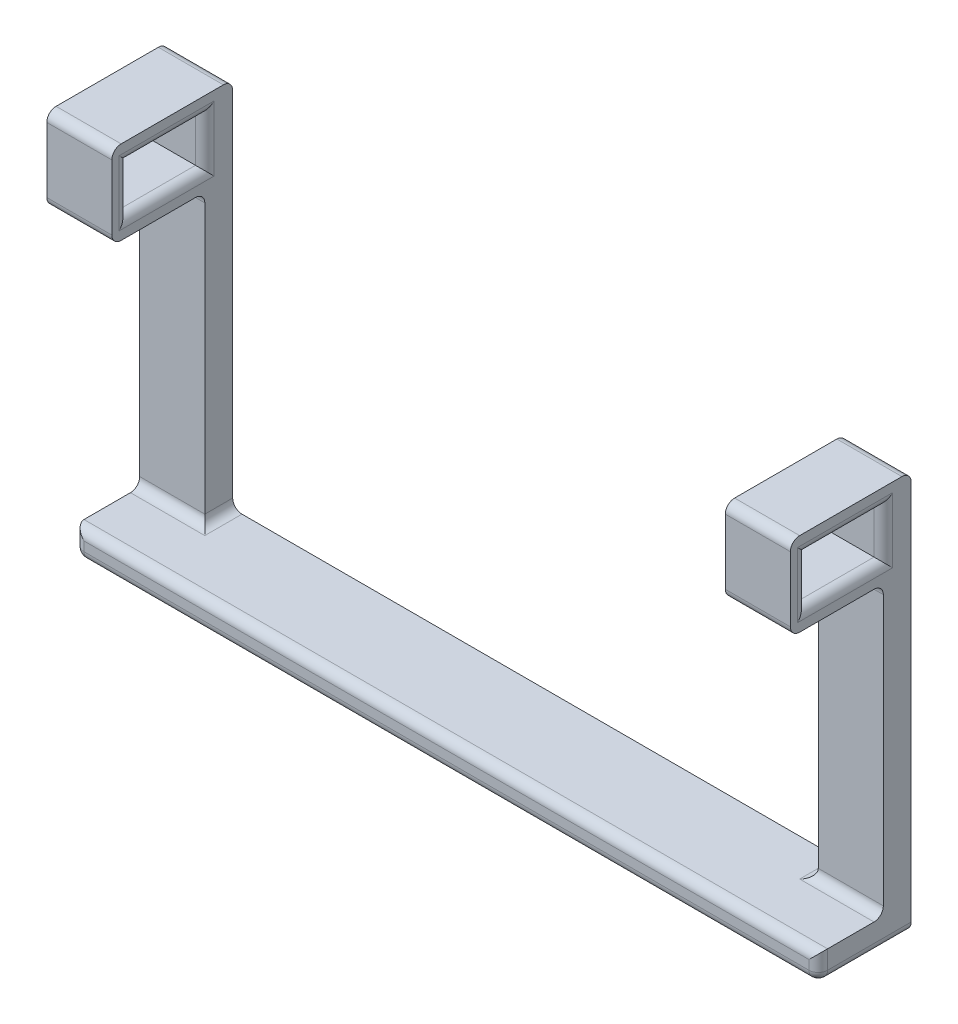
from build123d import *

# Parameters (mm, degrees)
BOSS_EXTRUDE1_DEPTH = 13
SKETCH2_W           = 8.229441325
SKETCH2_H           = 5
CUT_EXTRUDE1_DEPTH  = 100
FILLET1_R           = 1


with BuildPart() as part:
    # Sketch1 → Boss-Extrude1 (new body)
    with BuildSketch(Plane.XY):
        Polygon((0, 0), (40, 0), (40, 43), (33, 43), (33, 3), (0, 3), align=None)
    extrude(amount=BOSS_EXTRUDE1_DEPTH)

    # Sketch2 → Cut-Extrude1 (cut)
    with BuildSketch(Plane(origin=(40, 0, 0), x_dir=(0, 0, -1), z_dir=(1, 0, 0))):
        Polygon((-3, 34), (-13, 34), (-13, 0), (-10, 0), (-10, 3), (-3, 3), align=None)
        with Locations((-7.114720663, 38.5)):
            Rectangle(SKETCH2_W, SKETCH2_H)
    extrude(amount=-CUT_EXTRUDE1_DEPTH, mode=Mode.SUBTRACT)

    # Mirror2: part across plane


with BuildPart() as part_1:
    add(part.part)
    add(part.part.mirror(Plane(origin=(0, 0, 13), x_dir=(0, 0, 1), z_dir=(1, 0, 0))))

    # Fillet1
    fillet1_edges = [part_1.edges().sort_by_distance(p)[0] for p in [
        (-40, 0, 5),
        (0, 0, 10),
        (40, 0, 5),
        (40, 1.5, 10),
        (40, 38.5, 3),
        (40, 36, 7.114720663),
        (40, 38.5, 11.229441325),
        (40, 41, 7.114720663),
        (33, 41, 7.114720663),
        (33, 3, 1.5),
        (33, 38.5, 11.229441325),
        (33, 36, 7.114720663),
        (33, 38.5, 3),
        (36.5, 3, 3),
        (0, 3, 10),
        (-36.5, 3, 3),
        (-33, 3, 1.5),
        (-33, 41, 7.114720663),
        (-33, 38.5, 11.229441325),
        (-33, 36, 7.114720663),
        (-33, 38.5, 3),
        (-40, 38.5, 3),
        (-40, 36, 7.114720663),
        (-40, 38.5, 11.229441325),
        (-40, 41, 7.114720663),
        (-36.5, 43, 0),
        (-36.5, 43, 13),
        (-36.5, 34, 13),
        (-36.5, 34, 3),
        (36.5, 34, 3),
        (36.5, 34, 13),
        (36.5, 43, 13),
        (36.5, 43, 0),
        (-40, 1.5, 10),
    ]]
    fillet(fillet1_edges, radius=FILLET1_R)


solid = part_1.part
